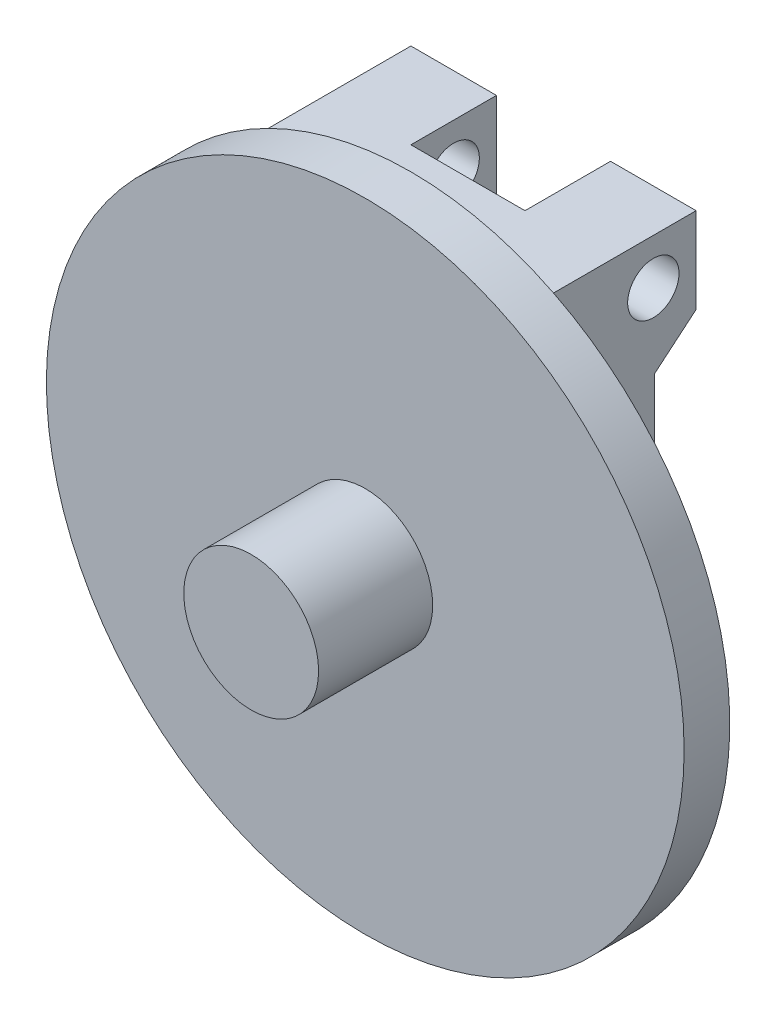
from build123d import *

# Parameters (mm, degrees)
SKETCH1_W           = 50
SKETCH1_H           = 100
BOSS_EXTRUDE1_DEPTH = 10
SKETCH10_R          = 4.5
BOSS_EXTRUDE2_DEPTH = 15
SKETCH11_R          = 55.901699437
BOSS_EXTRUDE3_DEPTH = 8
SKETCH13_R          = 11.817212027
BOSS_EXTRUDE4_DEPTH = 20


with BuildPart() as part:
    # Sketch1 → Boss-Extrude1 (new body)
    with BuildSketch(Plane.XY):
        Rectangle(SKETCH1_W, SKETCH1_H)
    extrude(amount=BOSS_EXTRUDE1_DEPTH)

    # Sketch10 → Boss-Extrude2 (add)
    with BuildSketch(Plane(origin=(25, 0, 0), x_dir=(0, 0, -1), z_dir=(1, 0, 0))):
        Polygon((0, 50), (15, 50), (15, 35), (7.685229658, 28.862178904), (7.685229658, -28.862178904), (15, -35), (15, -50), (0, -50), align=None)
        with Locations((7.5, 42)):
            Circle(SKETCH10_R, mode=Mode.SUBTRACT)
        with Locations((7.685229658, -42)):
            Circle(SKETCH10_R, mode=Mode.SUBTRACT)
    boss_extrude2 = extrude(amount=-BOSS_EXTRUDE2_DEPTH)

    # Mirror1: Boss-Extrude2 across plane
    add(boss_extrude2.mirror(Plane(origin=(0, 0, 0), x_dir=(0, 0, 1), z_dir=(1, 0, 0))))

    # Sketch11 → Boss-Extrude3 (add)
    with BuildSketch(Plane.XY.offset(10)):
        with Locations(Location((0, 0, 0), (0, 0, 116.565051177))):
            Circle(SKETCH11_R)
    extrude(amount=BOSS_EXTRUDE3_DEPTH)

    # Sketch13 → Boss-Extrude4 (add)
    with BuildSketch(Plane.XY.offset(18)):
        Circle(SKETCH13_R)
    extrude(amount=BOSS_EXTRUDE4_DEPTH)


solid = part.part
